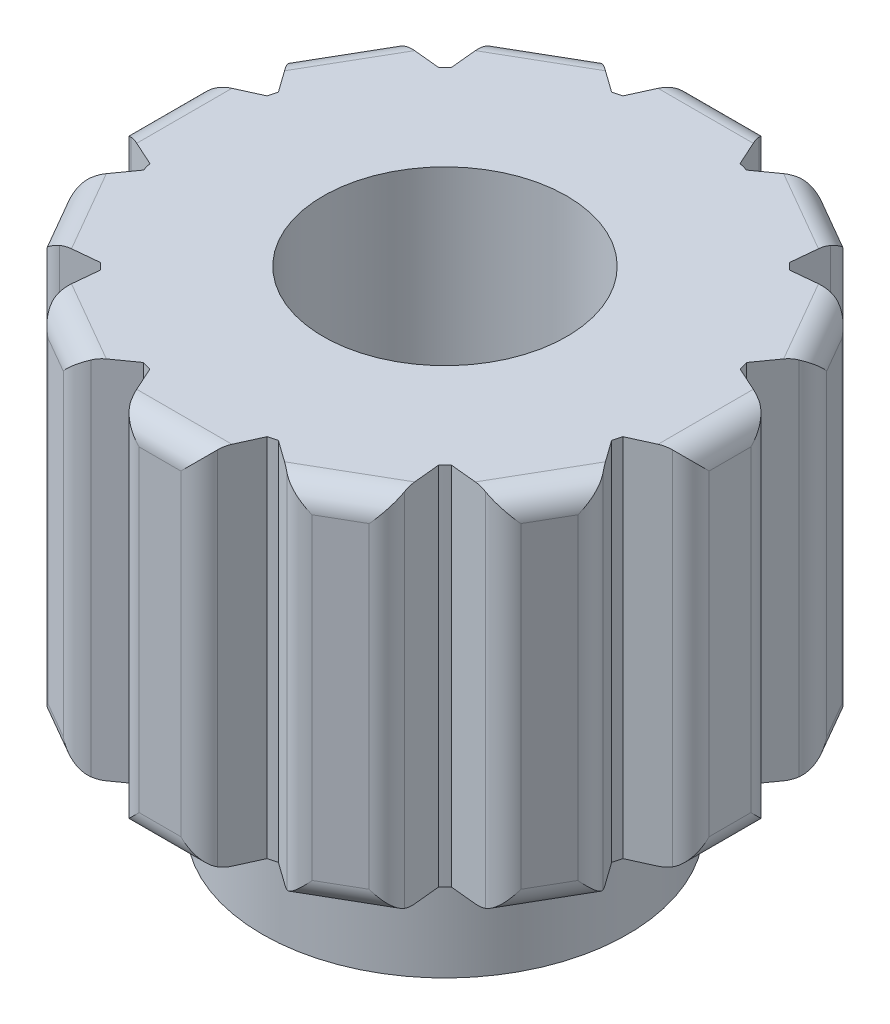
from build123d import *

# Parameters (mm, degrees)
SKETCH1_R           = 12.7
BOSS_EXTRUDE1_DEPTH = 19.05
BOSS_EXTRUDE2_DEPTH = 19.05
CIRPATTERN1_COUNT   = 12
FILLET1_R           = 1.27
SKETCH3_R           = 9.525
BOSS_EXTRUDE3_DEPTH = 6.35
SKETCH4_R           = 6.35
CUT_EXTRUDE1_DEPTH  = 33.965736182


with BuildPart() as part:
    # Sketch1 → Boss-Extrude1 (new body)
    with BuildSketch(Plane(origin=(0, 0, 0), x_dir=(1, 0, 0), z_dir=(0, 1, 0))):
        with Locations(Location((0, 0, 0), (0, 0, 90))):
            Circle(SKETCH1_R)
    extrude(amount=BOSS_EXTRUDE1_DEPTH)

    # Sketch2 → Boss-Extrude2 (add)
    with BuildSketch(Plane(origin=(0, 19.05, 0), x_dir=(1, 0, 0), z_dir=(0, 1, 0))):
        Polygon((-1.905, 14.859), (1.905, 14.859), (3.368404775, 11.639782335), (-3.368404775, 11.639782335), align=None)
    boss_extrude2 = extrude(amount=-BOSS_EXTRUDE2_DEPTH)

    # CirPattern1: Boss-Extrude2 ×12 about axis
    cirpattern1_axis = Axis((0, 0, 0), (0, 1, 0))
    for i in range(1, CIRPATTERN1_COUNT):
        add(boss_extrude2.rotate(cirpattern1_axis, i * 360 / CIRPATTERN1_COUNT))

    # Fillet1
    fillet1_edges = [part.edges().sort_by_distance(p)[0] for p in [
        (0, 19.05, -14.859),
        (1.905, 9.525, -14.859),
        (-12.868271475, 0, -7.4295),
        (-13.820771475, 9.525, -5.779721606),
        (-14.859, 0, 0),
        (-14.859, 9.525, 1.905),
        (-12.868271475, 0, 7.4295),
        (-11.915771475, 9.525, 9.079278394),
        (-7.4295, 0, 12.868271475),
        (-5.779721606, 9.525, 13.820771475),
        (0, 0, 14.859),
        (1.905, 9.525, 14.859),
        (7.4295, 0, 12.868271475),
        (9.079278394, 9.525, 11.915771475),
        (12.868271475, 0, 7.4295),
        (13.820771475, 9.525, 5.779721606),
        (14.859, 0, 0),
        (14.859, 9.525, -1.905),
        (12.868271475, 0, -7.4295),
        (11.915771475, 9.525, -9.079278394),
        (0, 0, -14.859),
        (7.4295, 0, -12.868271475),
        (5.779721606, 9.525, -13.820771475),
        (-1.905, 9.525, -14.859),
        (7.4295, 19.05, -12.868271475),
        (12.868271475, 19.05, -7.4295),
        (14.859, 19.05, 0),
        (12.868271475, 19.05, 7.4295),
        (7.4295, 19.05, 12.868271475),
        (0, 19.05, 14.859),
        (-7.4295, 19.05, 12.868271475),
        (-12.868271475, 19.05, 7.4295),
        (-14.859, 19.05, 0),
        (-12.868271475, 19.05, -7.4295),
        (-7.4295, 19.05, -12.868271475),
        (-5.779721606, 9.525, -13.820771475),
        (-11.915771475, 9.525, -9.079278394),
        (-14.859, 9.525, -1.905),
        (-13.820771475, 9.525, 5.779721606),
        (-9.079278394, 9.525, 11.915771475),
        (-1.905, 9.525, 14.859),
        (5.779721606, 9.525, 13.820771475),
        (11.915771475, 9.525, 9.079278394),
        (14.859, 9.525, 1.905),
        (13.820771475, 9.525, -5.779721606),
        (9.079278394, 9.525, -11.915771475),
        (-7.4295, 0, -12.868271475),
        (-9.079278394, 9.525, -11.915771475),
    ]]
    fillet(fillet1_edges, radius=FILLET1_R)

    # Sketch3 → Boss-Extrude3 (add)
    with BuildSketch(Plane.XZ):
        with Locations(Location((0, 0, 0), (0, 0, 90))):
            Circle(SKETCH3_R)
    extrude(amount=BOSS_EXTRUDE3_DEPTH)

    # Sketch4 → Cut-Extrude1 (cut, through all)
    with BuildSketch(Plane.XZ.offset(6.35)):
        with Locations(Location((0, 0, 0), (0, 0, 270))):
            Circle(SKETCH4_R)
    extrude(amount=-CUT_EXTRUDE1_DEPTH, mode=Mode.SUBTRACT)


solid = part.part
